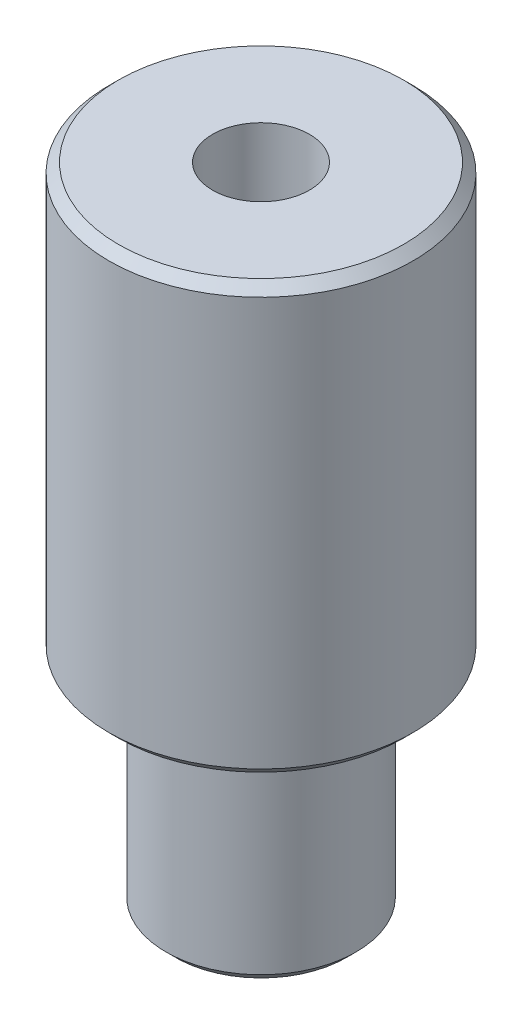
from build123d import *

# Parameters (mm, degrees)
CHAMFER1_SIZE                = 1
F_10_2_10_2_DIAMETER_HOLE1_D = 10.2


with BuildPart() as part:
    # Sketch1 → Revolve1 (revolve)
    with BuildSketch(Plane.XY, mode=Mode.PRIVATE) as revolve1_sk:
        Polygon((0, 0), (16, 0), (16, -45), (10, -45), (10, -68), (0, -68), align=None)
    revolve(revolve1_sk.sketch.rotate(Axis((0, -73, 0), (0, 1, 0)), 90), axis=Axis((0, -73, 0), (0, 1, 0)))

    # Chamfer1
    chamfer1_edges = [part.edges().sort_by_distance(p)[0] for p in [
        (0, -68, 10),
        (0, -45, 16),
        (0, 0, 16),
    ]]
    chamfer(chamfer1_edges, length=CHAMFER1_SIZE)

    # Ø10.2 (10.2) Diameter Hole1 (through all)
    with Locations(Plane(origin=(0, 0, 0), x_dir=(1, 0, 0), z_dir=(0, 1, 0))):
        with Locations((0, 0)):
            Hole(F_10_2_10_2_DIAMETER_HOLE1_D / 2)


solid = part.part
